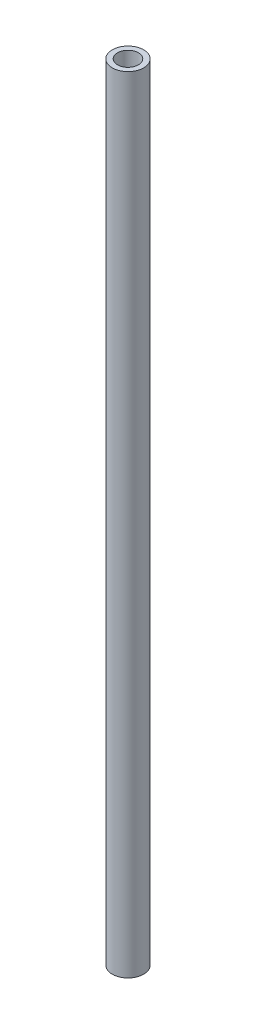
from build123d import *

# Parameters (mm, degrees)
SKETCH1_R           = 6
SKETCH1_R_2         = 4
BOSS_EXTRUDE1_DEPTH = 150


with BuildPart() as part:
    # Sketch1 → Boss-Extrude1 (new, symmetric)
    with BuildSketch(Plane(origin=(0, 0, 0), x_dir=(1, 0, 0), z_dir=(0, 1, 0))):
        with Locations(Location((0, 0, 0), (0, 0, 270))):
            Circle(SKETCH1_R)
        with Locations(Location((0, 0, 0), (0, 0, 270))):
            Circle(SKETCH1_R_2, mode=Mode.SUBTRACT)
    extrude(amount=BOSS_EXTRUDE1_DEPTH, both=True)


solid = part.part
